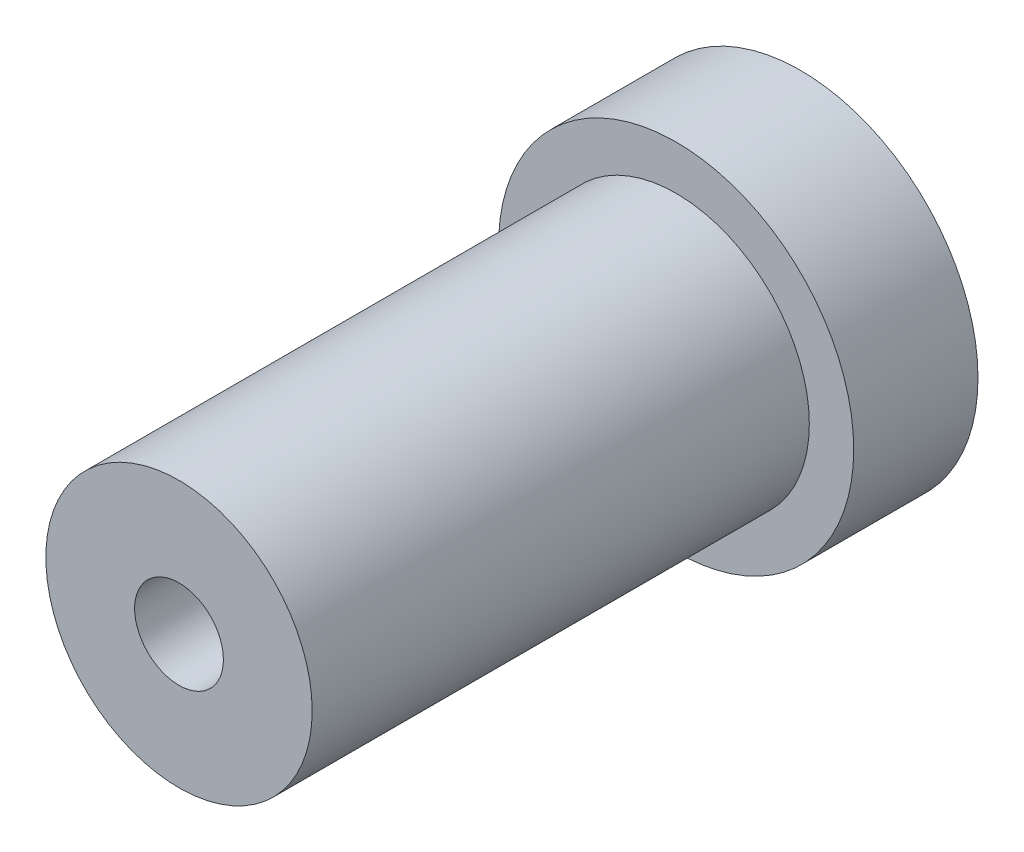
from build123d import *

# Parameters (mm, degrees)
SKETCH1_R           = 4
SKETCH1_R_2         = 1
BOSS_EXTRUDE1_DEPTH = 2.8
SKETCH2_R           = 3
SKETCH2_R_2         = 1
BOSS_EXTRUDE2_DEPTH = 11.2


with BuildPart() as part:
    # Sketch1 → Boss-Extrude1 (new body)
    with BuildSketch(Plane.XY):
        with Locations((-20, 10)):
            Circle(SKETCH1_R)
        with Locations((-20, 10)):
            Circle(SKETCH1_R_2, mode=Mode.SUBTRACT)
    extrude(amount=BOSS_EXTRUDE1_DEPTH)

    # Sketch2 → Boss-Extrude2 (add)
    with BuildSketch(Plane.XY.offset(2.8)):
        with Locations((-20, 10)):
            Circle(SKETCH2_R)
        with Locations((-20, 10)):
            Circle(SKETCH2_R_2, mode=Mode.SUBTRACT)
    extrude(amount=BOSS_EXTRUDE2_DEPTH)


solid = part.part
